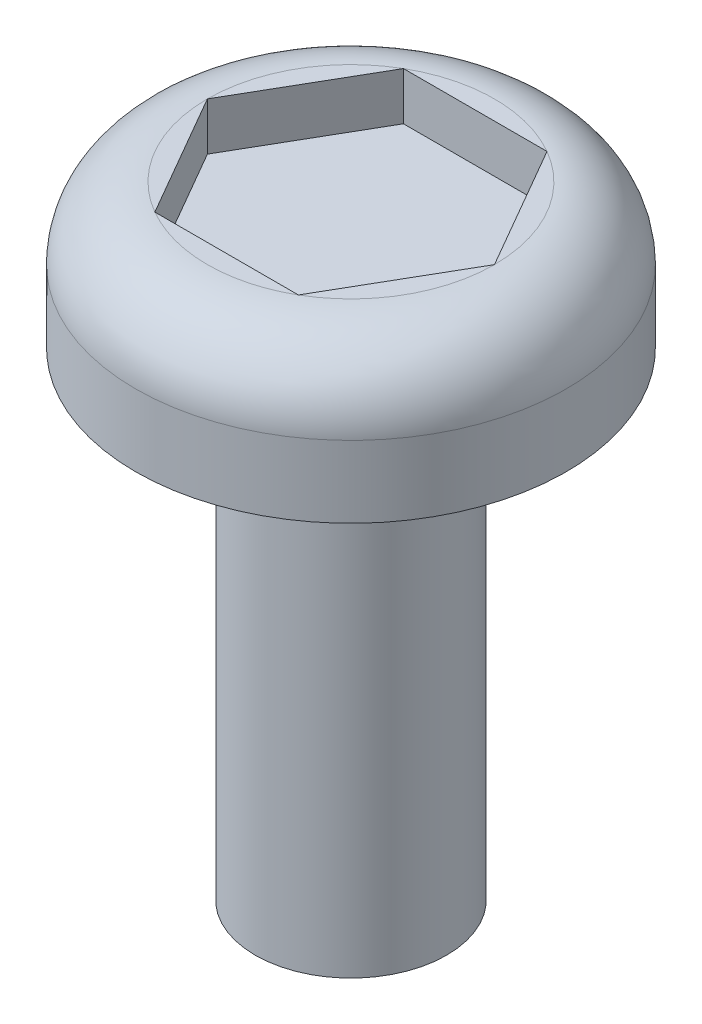
from build123d import *

# Parameters (mm, degrees)
SKETCH1_R           = 1
BOSS_EXTRUDE1_DEPTH = 5
SKETCH2_R           = 2.25
BOSS_EXTRUDE2_DEPTH = 1.5
FILLET1_R           = 0.75
CUT_EXTRUDE1_DEPTH  = 0.5


with BuildPart() as part:
    # Sketch1 → Boss-Extrude1 (new body)
    with BuildSketch(Plane(origin=(0, 0, 0), x_dir=(1, 0, 0), z_dir=(0, 1, 0))):
        with Locations(Location((0, 0, 0), (0, 0, 270))):
            Circle(SKETCH1_R)
    extrude(amount=BOSS_EXTRUDE1_DEPTH)

    # Sketch2 → Boss-Extrude2 (add)
    with BuildSketch(Plane(origin=(0, 5, 0), x_dir=(1, 0, 0), z_dir=(0, 1, 0))):
        with Locations(Location((0, 0, 0), (0, 0, 270))):
            Circle(SKETCH2_R)
    extrude(amount=BOSS_EXTRUDE2_DEPTH)

    # Fillet1
    fillet1_edges = [part.edges().sort_by_distance(p)[0] for p in [
        (0, 6.5, -2.25),
    ]]
    fillet(fillet1_edges, radius=FILLET1_R)

    # Sketch3 → Cut-Extrude1 (cut)
    with BuildSketch(Plane(origin=(0, 6.5, 0), x_dir=(1, 0, 0), z_dir=(0, 1, 0))):
        Polygon((1.5, 0), (0.75, 1.299038106), (-0.75, 1.299038106), (-1.5, 0), (-0.75, -1.299038106), (0.75, -1.299038106), align=None)
    extrude(amount=-CUT_EXTRUDE1_DEPTH, mode=Mode.SUBTRACT)


solid = part.part
